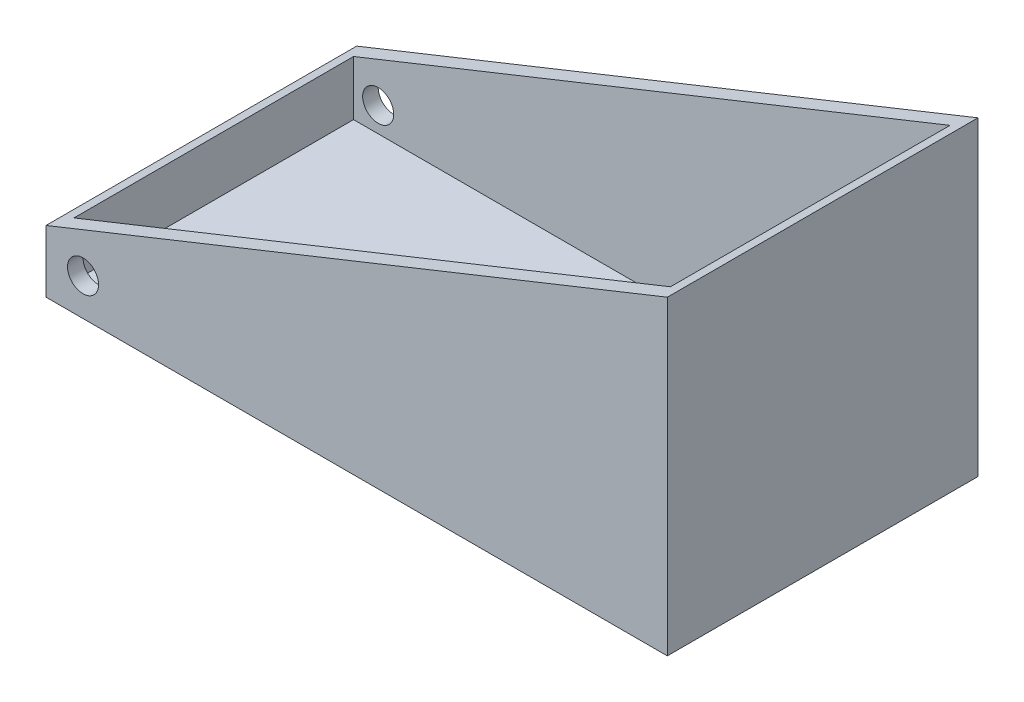
from build123d import *

# Parameters (mm, degrees)
BOSS_EXTRUDE1_DEPTH = 50
CUT_EXTRUDE9_START  = -2
SKETCH3_W           = 96
SKETCH3_H           = 45
CUT_EXTRUDE9_DEPTH  = 121.474487139
SKETCH4_R           = 2.5
CUT_EXTRUDE10_DEPTH = 122.509301877


with BuildPart() as part:
    # Sketch1 → Boss-Extrude1 (new body)
    with BuildSketch(Plane.XY):
        Polygon((0, 0.250965251), (0, 7.586872587), (100, 47.586872587), (100, -2.413127413), (0, -2.413127413), align=None)
    extrude(amount=BOSS_EXTRUDE1_DEPTH)

    # Sketch3 → Cut-Extrude9 (cut, through all)
    with BuildSketch(Plane.XZ.offset(2.413127413).offset(CUT_EXTRUDE9_START)):
        with Locations((50, 25)):
            Rectangle(SKETCH3_W, SKETCH3_H)
    extrude(amount=-CUT_EXTRUDE9_DEPTH, mode=Mode.SUBTRACT)

    # Sketch4 → Cut-Extrude10 (cut, through all)
    with BuildSketch(Plane(origin=(0, 0, 0), x_dir=(-1, 0, 0), z_dir=(0, 0, -1))):
        with Locations((-5.962912018, 3.549784605)):
            Circle(SKETCH4_R)
    extrude(amount=-CUT_EXTRUDE10_DEPTH, mode=Mode.SUBTRACT)


solid = part.part
